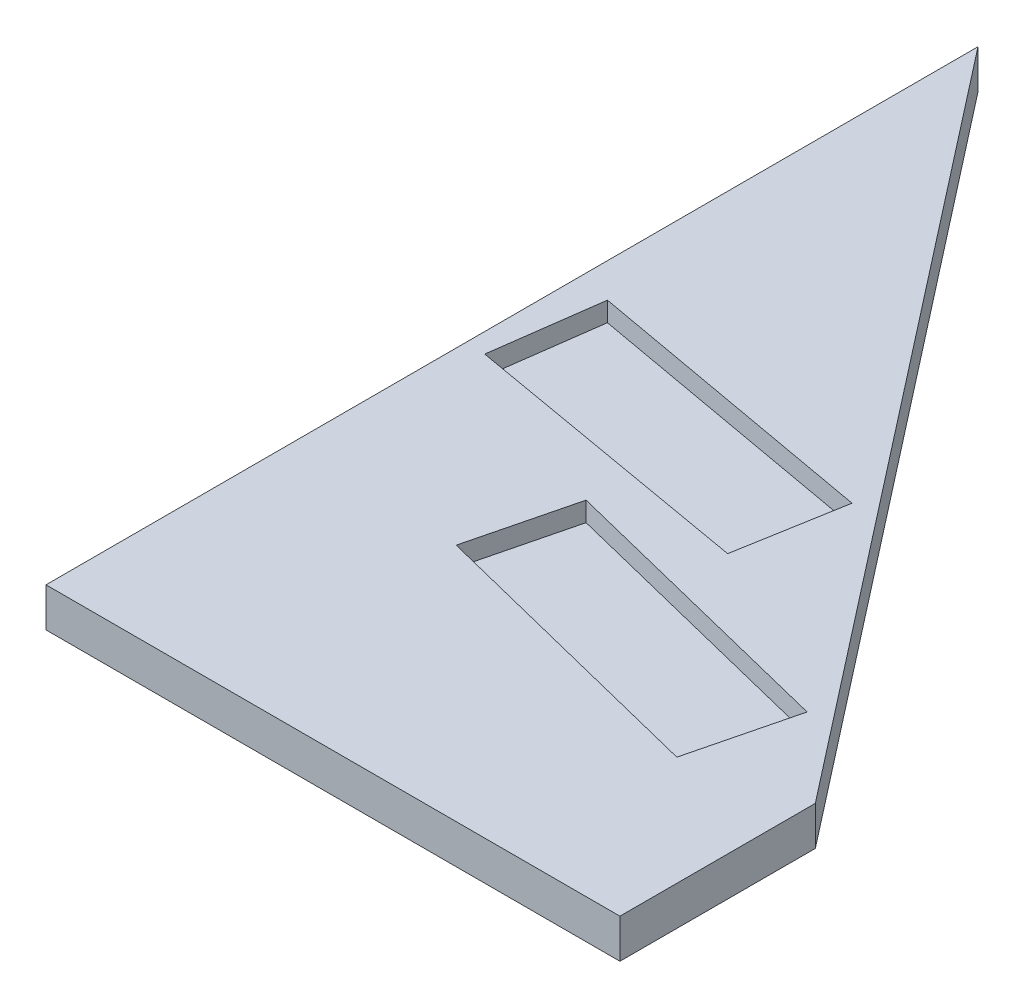
from build123d import *

# Parameters (mm, degrees)
BOSS_EXTRUDE1_DEPTH = 4
CUT_EXTRUDE1_DEPTH  = 2
CUT_EXTRUDE2_DEPTH  = 2


with BuildPart() as part:
    # Sketch1 → Boss-Extrude1 (new body)
    with BuildSketch(Plane(origin=(0, 0, 0), x_dir=(1, 0, 0), z_dir=(0, 1, 0))):
        Polygon((-25, 50.39), (33.74, -25), (33.74, -45), (-25, -45), align=None)
    extrude(amount=BOSS_EXTRUDE1_DEPTH)

    # Sketch2 → Cut-Extrude1 (cut)
    with BuildSketch(Plane(origin=(0, 4, 0), x_dir=(1, 0, 0), z_dir=(0, 1, 0))):
        Polygon((-23, -2.0971477), (7.121683168, -7.35422298), (9.012903271, 3.481979608), (-21.498978305, 8.961494434), align=None)
    extrude(amount=-CUT_EXTRUDE1_DEPTH, mode=Mode.SUBTRACT)

    # Sketch4 → Cut-Extrude2 (cut)
    with BuildSketch(Plane(origin=(0, 4, 0), x_dir=(1, 0, 0), z_dir=(0, 1, 0))):
        Polygon((-4.867869217, -9.85422298), (25.219953937, -17.319000128), (22.558813085, -27.992253117), (-7.520354429, -20.492674354), align=None)
    extrude(amount=-CUT_EXTRUDE2_DEPTH, mode=Mode.SUBTRACT)


solid = part.part
